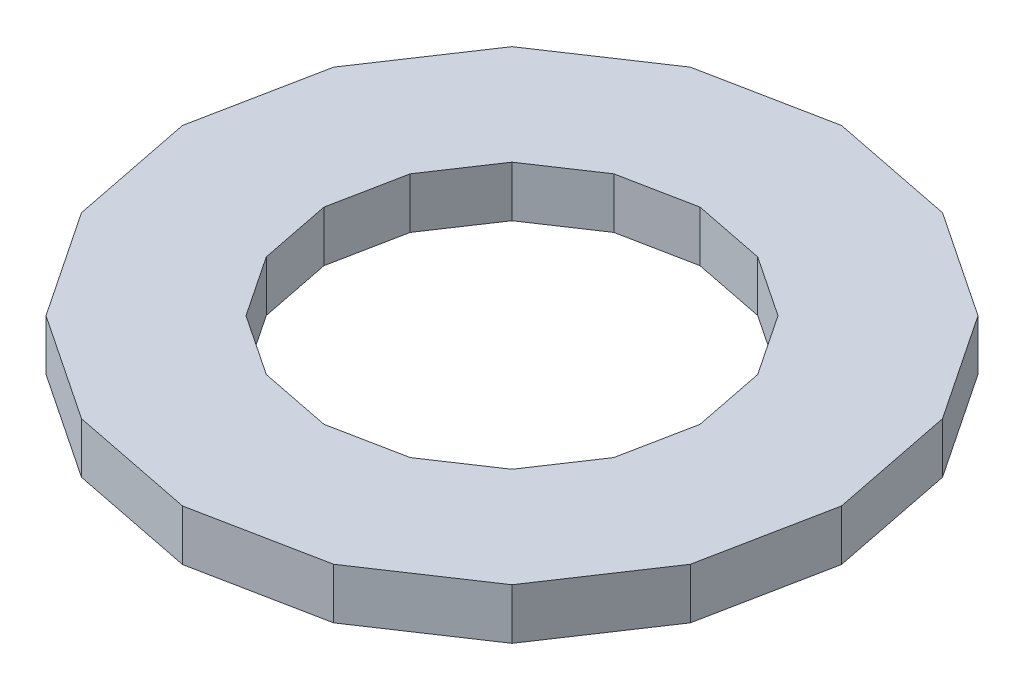
from build123d import *

# Parameters (mm, degrees)
BOSS_EXTRUDE1_DEPTH = 19.05


with BuildPart() as part:
    # Sketch1 → Boss-Extrude1 (new body)
    with BuildSketch(Plane(origin=(0, 0, 0), x_dir=(1, 0, 0), z_dir=(0, 1, 0))):
        Polygon((123.686299508, 0), (114.271240568, 47.332697632), (87.459421122, 87.459421122), (47.332697632, 114.271240568), (0, 123.686299508), (-47.332697632, 114.271240568), (-87.459421122, 87.459421122), (-114.271240568, 47.332697632), (-123.686299508, 0), (-114.271240568, -47.332697632), (-87.459421122, -87.459421122), (-47.332697632, -114.271240568), (0, -123.686299508), (47.332697632, -114.271240568), (87.459421122, -87.459421122), (114.271240568, -47.332697632), align=None)
        Polygon((70.5961879, 0), (65.222373074, 27.015991498), (49.91904319, 49.91904319), (27.015991497, 65.222373074), (0, 70.5961879), (-27.015991498, 65.222373074), (-49.91904319, 49.91904319), (-65.222373074, 27.015991497), (-70.5961879, 0), (-65.222373074, -27.015991498), (-49.91904319, -49.91904319), (-27.015991497, -65.222373074), (0, -70.5961879), (27.015991498, -65.222373074), (49.91904319, -49.91904319), (65.222373074, -27.015991497), align=None, mode=Mode.SUBTRACT)
    extrude(amount=BOSS_EXTRUDE1_DEPTH)


solid = part.part
